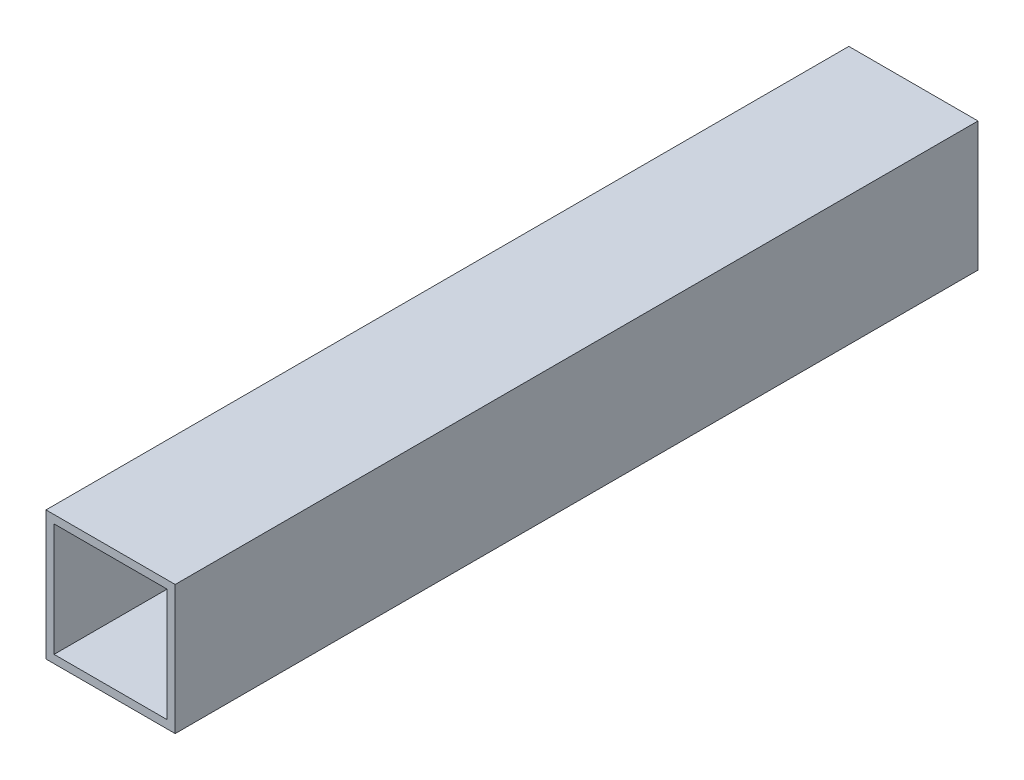
from build123d import *

# Parameters (mm, degrees)
SKETCH1_W           = 50.8
SKETCH1_H           = 50.8
SKETCH1_W_2         = 44.45
SKETCH1_H_2         = 44.45
BOSS_EXTRUDE1_DEPTH = 315.722


with BuildPart() as part:
    # Sketch1 → Boss-Extrude1 (new body)
    with BuildSketch(Plane.XY):
        with Locations((16.685638298, 12.429787234)):
            Rectangle(SKETCH1_W, SKETCH1_H)
        with Locations((16.685638298, 12.429787234)):
            Rectangle(SKETCH1_W_2, SKETCH1_H_2, mode=Mode.SUBTRACT)
    extrude(amount=BOSS_EXTRUDE1_DEPTH)


solid = part.part
